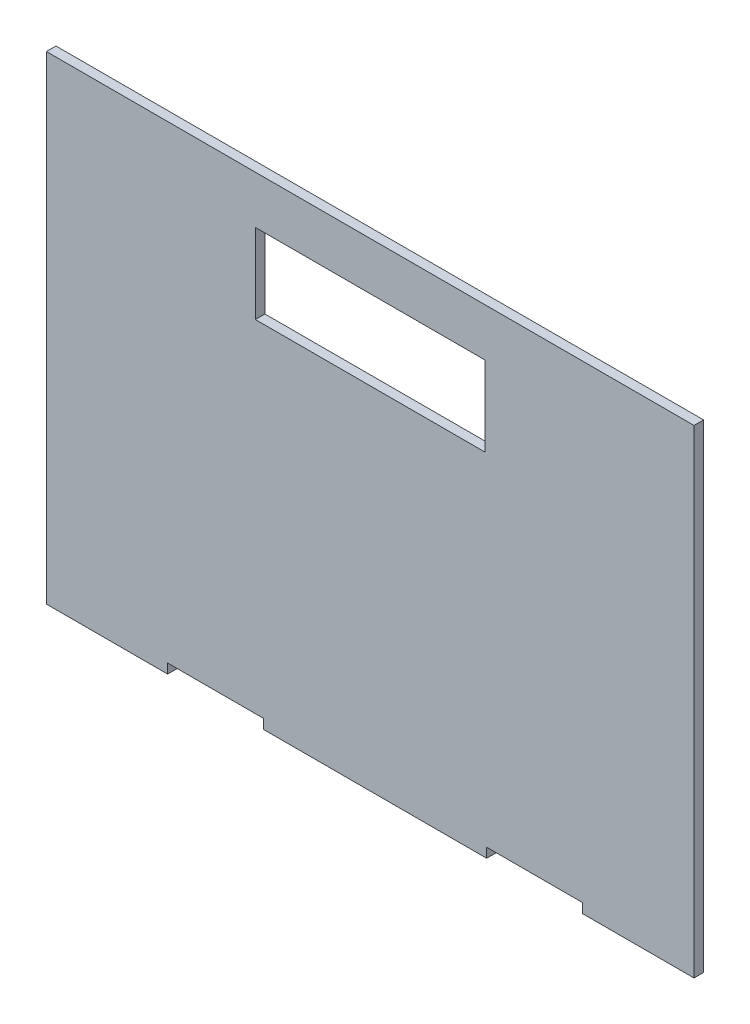
from build123d import *

# Parameters (mm, degrees)
SKETCH1_W           = 203
SKETCH1_H           = 150
BOSS_EXTRUDE1_DEPTH = 3
SKETCH2_W           = 72
SKETCH2_H           = 25
CUT_EXTRUDE1_DEPTH  = 10
SKETCH3_W           = 30
SKETCH3_H           = 3
CUT_EXTRUDE2_DEPTH  = 10


with BuildPart() as part:
    # Sketch1 → Boss-Extrude1 (new body)
    with BuildSketch(Plane.XY):
        Rectangle(SKETCH1_W, SKETCH1_H)
    extrude(amount=BOSS_EXTRUDE1_DEPTH)

    # Sketch2 → Cut-Extrude1 (cut)
    with BuildSketch(Plane.XY.offset(3)):
        with Locations((0, 47.5)):
            Rectangle(SKETCH2_W, SKETCH2_H)
    extrude(amount=-CUT_EXTRUDE1_DEPTH, mode=Mode.SUBTRACT)

    # Sketch3 → Cut-Extrude2 (cut)
    with BuildSketch(Plane.XY.offset(3)):
        with Locations((-48.5, -73.5)):
            Rectangle(SKETCH3_W, SKETCH3_H)
        with Locations((51.5, -73.5)):
            Rectangle(SKETCH3_W, SKETCH3_H)
    extrude(amount=-CUT_EXTRUDE2_DEPTH, mode=Mode.SUBTRACT)


solid = part.part
